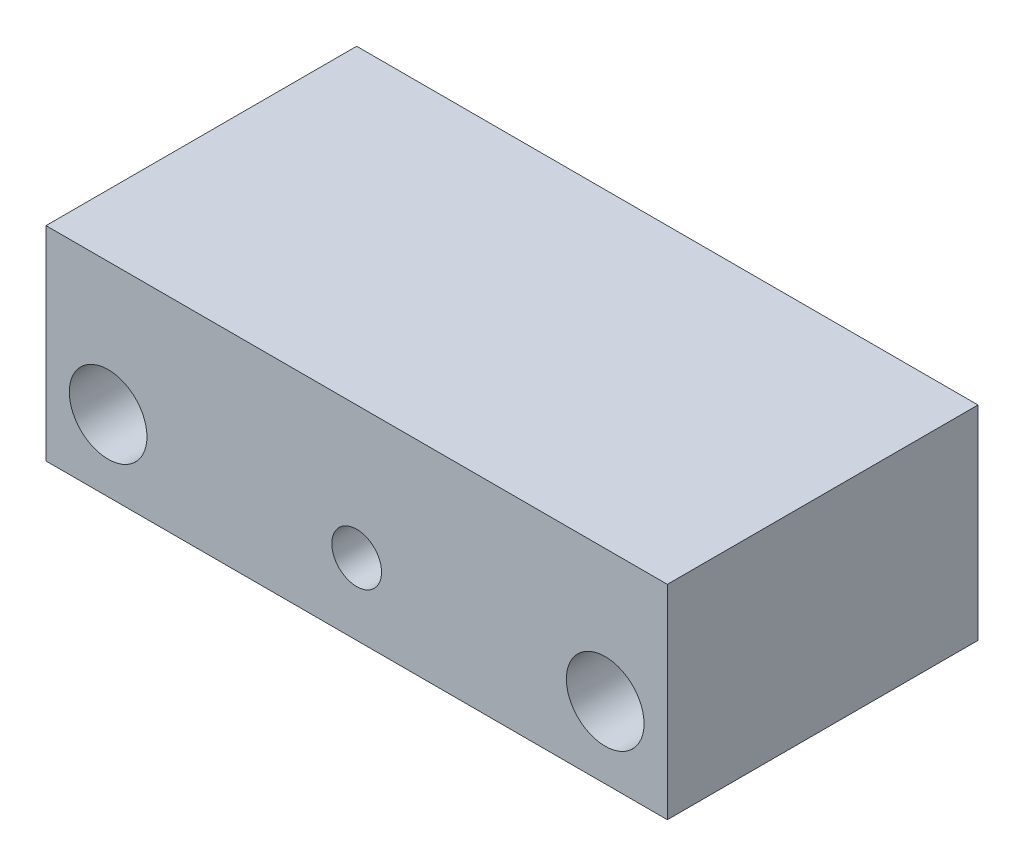
from build123d import *

# Parameters (mm, degrees)
SKETCH_1_W      = 200
SKETCH_1_H      = 65.63
SKETCH_1_R      = 12.5
SKETCH_1_R_2    = 8
EXTRUDE_1_DEPTH = 100


with BuildPart() as part:
    # 草图1 → 凸台-拉伸1 (new body)
    with BuildSketch(Plane.XY):
        with Locations((100, 32.815)):
            Rectangle(SKETCH_1_W, SKETCH_1_H)
        with Locations((20, 23)):
            Circle(SKETCH_1_R, mode=Mode.SUBTRACT)
        with Locations((100, 23)):
            Circle(SKETCH_1_R_2, mode=Mode.SUBTRACT)
        with Locations((180, 23)):
            Circle(SKETCH_1_R, mode=Mode.SUBTRACT)
    extrude(amount=EXTRUDE_1_DEPTH)


solid = part.part
